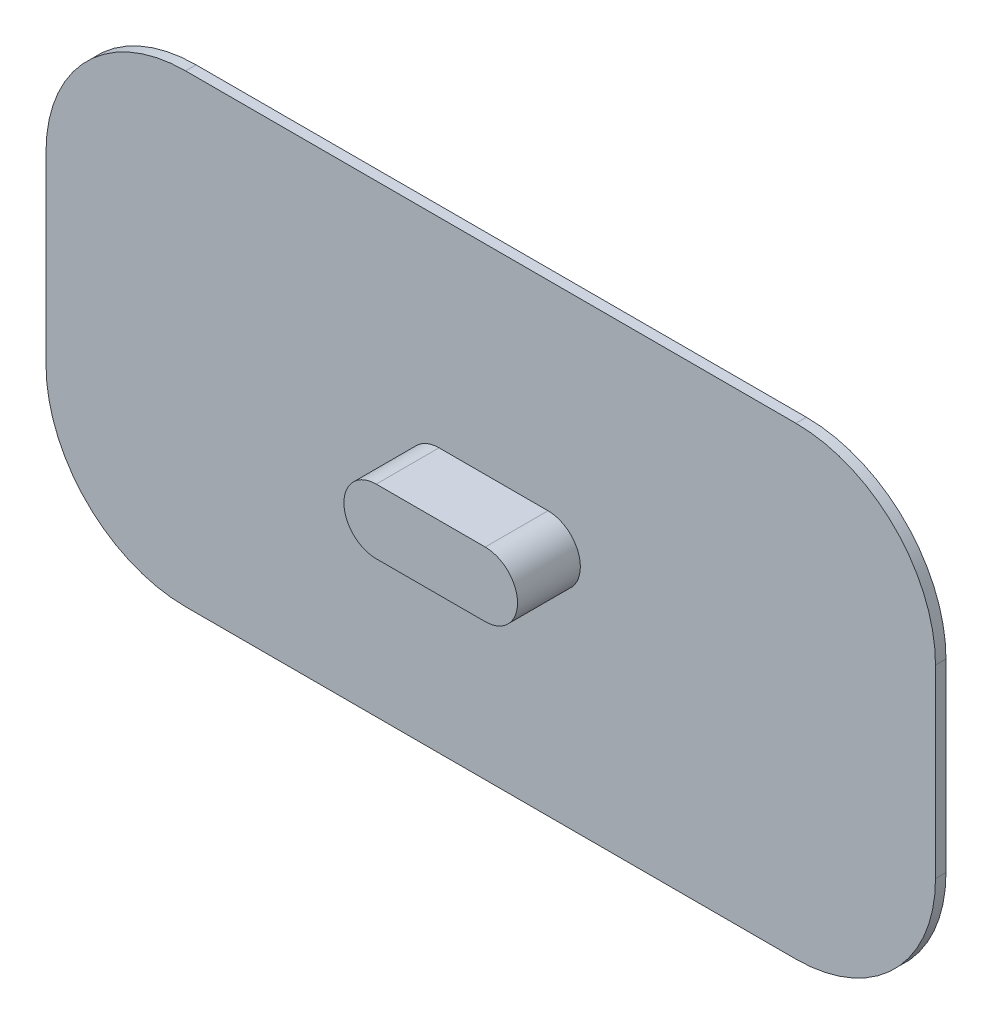
from build123d import *

# Parameters (mm, degrees)
EXTRUDE_1_DEPTH = 3
EXTRUDE_2_DEPTH = 18


with BuildPart() as part:
    # 草图1 → 凸台-拉伸1 (new body)
    with BuildSketch(Plane.XY):
        with BuildLine():
            Line((87.45, 66.5), (-87.45, 66.5))
            ThreePointArc((-87.45, 66.5), (-115.734271247, 54.784271247), (-127.45, 26.5))
            Line((-127.45, 26.5), (-127.45, -26.5))
            ThreePointArc((-127.45, -26.5), (-115.734271247, -54.784271247), (-87.45, -66.5))
            Line((-87.45, -66.5), (87.45, -66.5))
            ThreePointArc((87.45, -66.5), (115.734271247, -54.784271247), (127.45, -26.5))
            Line((127.45, -26.5), (127.45, 26.5))
            ThreePointArc((127.45, 26.5), (115.734271247, 54.784271247), (87.45, 66.5))
        make_face()
    extrude(amount=EXTRUDE_1_DEPTH)

    # 草图2 → 凸台-拉伸2 (add)
    with BuildSketch(Plane.XY.offset(3)):
        with BuildLine():
            Line((-14.821826733, 9.263641708), (16.409879597, 9.263641708))
            ThreePointArc((16.409879597, 9.263641708), (25.673521305, 0), (16.409879597, -9.263641708))
            Line((16.409879597, -9.263641708), (-14.821826733, -9.263641708))
            ThreePointArc((-14.821826733, -9.263641708), (-24.085468441, 0), (-14.821826733, 9.263641708))
        make_face()
    extrude(amount=EXTRUDE_2_DEPTH)


solid = part.part
